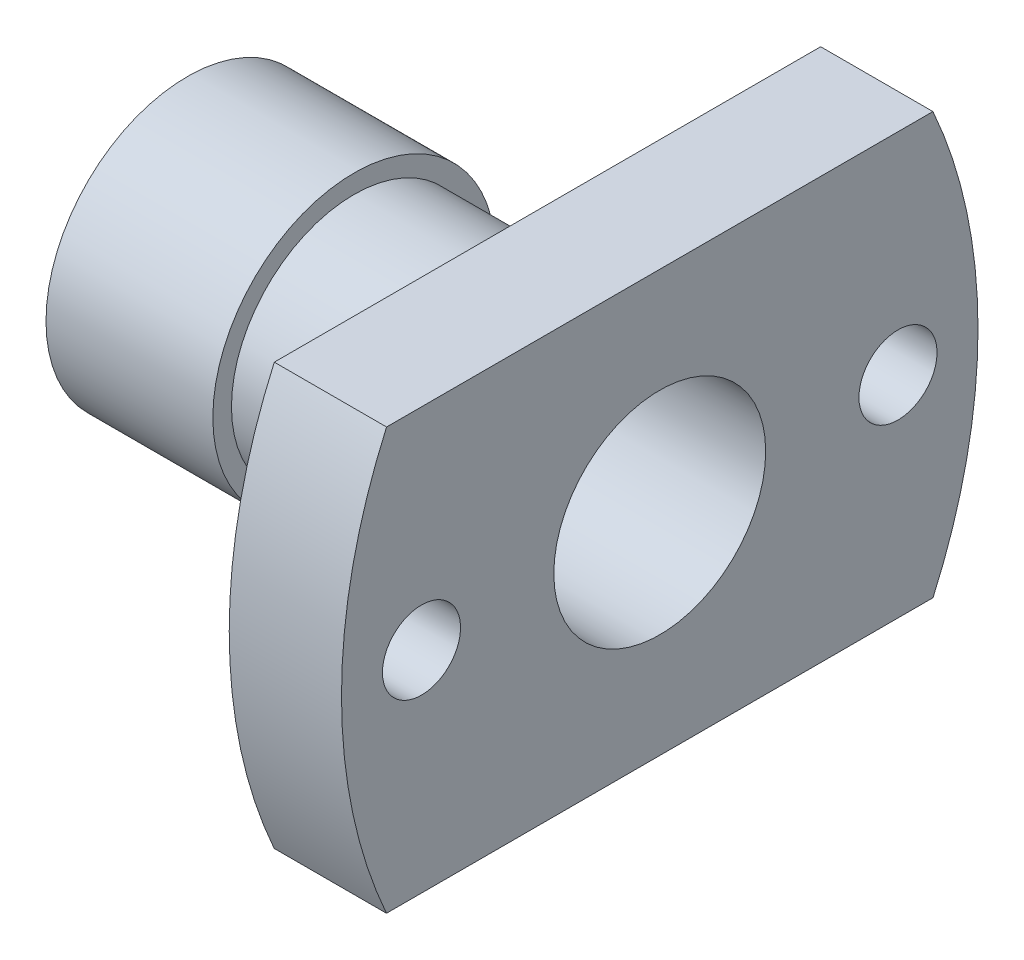
from build123d import *

# Parameters (mm, degrees)
BOSS_EXTRUDE1_DEPTH = 6.73
CUT_EXTRUDE5_DEPTH  = 6.73
SKETCH4_R           = 7.35
BOSS_EXTRUDE2_DEPTH = 21.59
SKETCH5_R           = 6.35
CUT_EXTRUDE6_DEPTH  = 46.540850343
BOSS_EXTRUDE3_START = -10
SKETCH6_R           = 8.466621056
SKETCH6_R_2         = 7.35
BOSS_EXTRUDE3_DEPTH = 10
SKETCH7_R           = 2.5
SKETCH7_R_2         = 2.34
BOSS_EXTRUDE4_DEPTH = 6.73


with BuildPart() as part:
    # Sketch1 → Boss-Extrude1 (new body)
    with BuildSketch(Plane(origin=(0, 0, 0), x_dir=(0, 0, -1), z_dir=(1, 0, 0))):
        with BuildLine():
            Line((14.28, 0), (2.5, 0))
            ThreePointArc((2.5, 0), (0, -2.5), (-2.5, 0))
            Line((-2.5, 0), (-4.795, 0))
            Line((-4.795, 0), (-4.795, -12.615))
            Line((-4.795, -12.615), (14.28, -12.615))
            Line((14.28, -12.615), (14.28, 0))
        make_face()
        with BuildLine():
            ThreePointArc((-2.5, 0), (0, 2.5), (2.5, 0))
            Line((2.5, 0), (14.28, 0))
            Line((14.28, 0), (14.28, 12.625))
            Line((14.28, 12.625), (-4.795, 12.625))
            Line((-4.795, 12.625), (-4.795, 0))
            Line((-4.795, 0), (-2.5, 0))
        make_face()
        with BuildLine():
            Line((14.28, 12.625), (14.28, 0))
            Line((14.28, 0), (26.06, 0))
            ThreePointArc((26.06, 0), (28.56, 2.5), (31.06, 0))
            Line((31.06, 0), (33.355, 0))
            Line((33.355, 0), (33.355, 12.625))
            Line((33.355, 12.625), (14.28, 12.625))
        make_face()
        with BuildLine():
            Line((26.06, 0), (14.28, 0))
            Line((14.28, 0), (14.28, -12.615))
            Line((14.28, -12.615), (33.355, -12.615))
            Line((33.355, -12.615), (33.355, 0))
            Line((33.355, 0), (31.06, 0))
            ThreePointArc((31.06, 0), (28.56, -2.5), (26.06, 0))
        make_face()
    extrude(amount=BOSS_EXTRUDE1_DEPTH)

    # Sketch3 → Cut-Extrude5 (cut)
    with BuildSketch(Plane.ZY):
        with BuildLine():
            Line((4.795, -12.615), (4.795, 0))
            ThreePointArc((4.795, 0), (4.113307599, -6.450002601), (2.098352225, -12.615))
            Line((2.098352225, -12.615), (4.795, -12.615))
        make_face()
        with BuildLine():
            Line((4.795, 12.625), (2.093870071, 12.625))
            ThreePointArc((2.093870071, 12.625), (4.112161723, 6.455360716), (4.795, 0))
            Line((4.795, 0), (4.795, 12.625))
        make_face()
        with BuildLine():
            ThreePointArc((-33.355, 1.23e-07), (-32.67216171, 6.455360776), (-30.653870071, 12.625))
            Line((-30.653870071, 12.625), (-33.355, 12.625))
            Line((-33.355, 12.625), (-33.355, 1.23e-07))
        make_face()
        with BuildLine():
            ThreePointArc((-30.658352225, -12.615), (-32.673307611, -6.450002541), (-33.355, 1.23e-07))
            Line((-33.355, 1.23e-07), (-33.355, -12.615))
            Line((-33.355, -12.615), (-30.658352225, -12.615))
        make_face()
    extrude(amount=-CUT_EXTRUDE5_DEPTH, mode=Mode.SUBTRACT)

    # Sketch4 → Boss-Extrude2 (add)
    with BuildSketch(Plane.ZY):
        with Locations(Location((-14.28, 0, 0), (0, 0, 180))):
            Circle(SKETCH4_R)
    extrude(amount=BOSS_EXTRUDE2_DEPTH)

    # Sketch5 → Cut-Extrude6 (cut, through all)
    with BuildSketch(Plane.ZY.offset(21.59)):
        with Locations((-14.28, 0)):
            Circle(SKETCH5_R)
    extrude(amount=-CUT_EXTRUDE6_DEPTH, mode=Mode.SUBTRACT)

    # Sketch6 → Boss-Extrude3 (add)
    with BuildSketch(Plane.ZY.offset(21.59).offset(BOSS_EXTRUDE3_START)):
        with Locations((-14.28, 0)):
            Circle(SKETCH6_R)
        with Locations(Location((-14.28, 0, 0), (0, 0, 180))):
            Circle(SKETCH6_R_2, mode=Mode.SUBTRACT)
    extrude(amount=BOSS_EXTRUDE3_DEPTH)

    # Sketch7 → Boss-Extrude4 (add, through all)
    # profile 1 of 2: a face of its own
    with BuildSketch(Plane.ZY):
        with Locations((-28.56, 0)):
            Circle(SKETCH7_R)
        with Locations((-28.56, 0)):
            Circle(SKETCH7_R_2, mode=Mode.SUBTRACT)
    # profile 2 of 2: a face of its own
    with BuildSketch(Plane.ZY):
        Circle(SKETCH7_R)
        Circle(SKETCH7_R_2, mode=Mode.SUBTRACT)
    extrude(amount=-BOSS_EXTRUDE4_DEPTH)


solid = part.part
